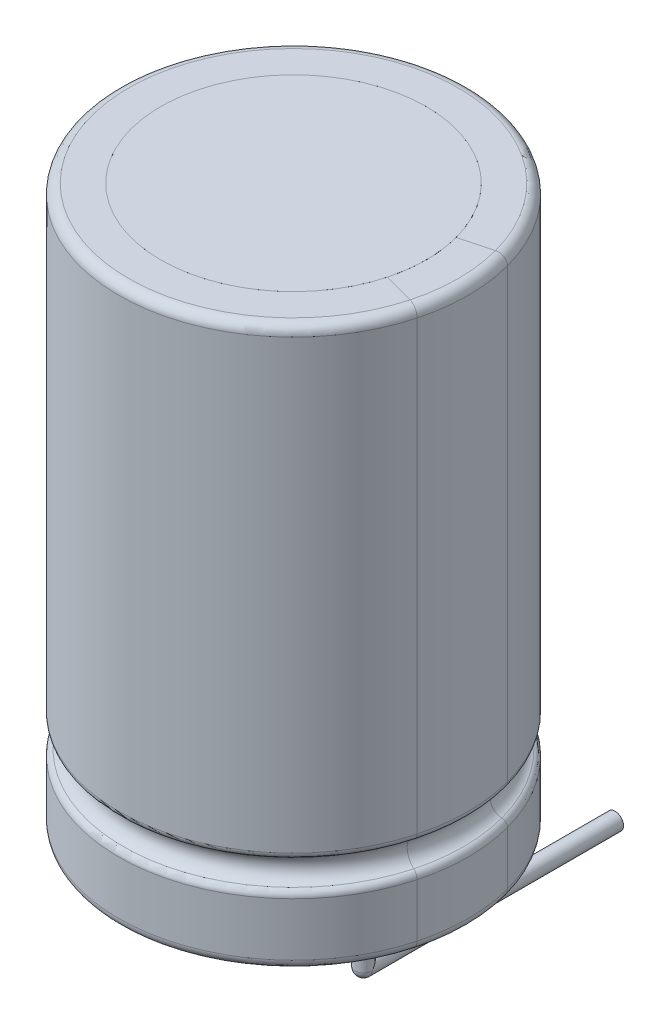
from build123d import *

# Parameters (mm, degrees)
SALIENTE_EXTRUIR2_DEPTH   = 20
SALIENTE_EXTRUIR3_DEPTH   = 20
SALIENTE_EXTRUIR4_DEPTH   = 20
REDONDEO1_R               = 0.35
REDONDEO2_R               = 0.35
REDONDEO3_R               = 0.35
CROQUIS3_R                = 0.5000000000000007
REDONDEO4_R               = 0.25
REDONDEO5_R               = 0.25
CROQUIS4_R                = 0.3000000000000001
SALIENTE_EXTRUIR7_DEPTH   = 3
SALIENTE_EXTRUIR7_2_DEPTH = 3
CROQUIS7_R                = 0.3000000000000001
SALIENTE_EXTRUIR9_DEPTH   = 9


with BuildPart() as part:
    # Croquis2 → Saliente-Extruir2 (new body)
    with BuildSketch(Plane(origin=(0, 0, 0), x_dir=(1, 0, 0), z_dir=(0, 1, 0))):
        with BuildLine():
            ThreePointArc((4.75, 0), (4.709363091525599, 0.619999413045247), (4.588147674873073, 1.2293904642369773))
            ThreePointArc((4.588147674873073, 1.2293904642369773), (-4.75, 5.8e-16), (4.588147674873073, -1.2293904642369775))
            ThreePointArc((4.588147674873073, -1.2293904642369775), (4.709363091525598, -0.6199994130452497), (4.75, -1.16e-15))
        make_face()
    extrude(amount=SALIENTE_EXTRUIR2_DEPTH)


with BuildPart() as body_2:
    # Croquis2<4> → Saliente-Extruir3 (new body)
    with BuildSketch(Plane(origin=(0, 0, 0), x_dir=(1, 0, 0), z_dir=(0, 1, 0))):
        with BuildLine():
            ThreePointArc((4.588147674873073, -1.2293904642369775), (-4.75, 5.8e-16), (4.588147674873073, 1.2293904642369773))
            Line((4.588147674873073, 1.2293904642369773), (6.037036414306675, 1.6176190318907595))
            ThreePointArc((6.037036414306676, 1.6176190318907597), (-6.25, -2.01e-15), (6.037036414306676, -1.6176190318907597))
            Line((6.037036414306676, -1.6176190318907584), (4.588147674873074, -1.2293904642369764))
        make_face()
    extrude(amount=SALIENTE_EXTRUIR3_DEPTH)

    # Redondeo1
    redondeo1_edges = [body_2.edges().sort_by_distance(p)[0] for p in [
        (-6.25, 20, 1.1e-16),
    ]]
    fillet(redondeo1_edges, radius=REDONDEO1_R)

    # Redondeo3
    redondeo3_edges = [body_2.edges().sort_by_distance(p)[0] for p in [
        (-6.25, 0, 1.1e-16),
    ]]
    fillet(redondeo3_edges, radius=REDONDEO3_R)


with BuildPart() as body_3:
    # Croquis2<5> → Saliente-Extruir4 (new body)
    with BuildSketch(Plane(origin=(0, 0, 0), x_dir=(1, 0, 0), z_dir=(0, 1, 0))):
        with BuildLine():
            Line((6.037036414306675, 1.6176190318907595), (4.588147674873073, 1.2293904642369773))
            ThreePointArc((4.588147674873073, 1.2293904642369773), (4.709363091525599, 0.619999413045247), (4.75, 0))
            ThreePointArc((4.75, -1.16e-15), (4.709363091525598, -0.6199994130452497), (4.588147674873073, -1.2293904642369775))
            Line((4.588147674873074, -1.2293904642369764), (6.037036414306676, -1.6176190318907584))
            ThreePointArc((6.037036414306676, -1.6176190318907597), (6.196530383586314, -0.8157887013753286), (6.25, -1.53e-15))
            ThreePointArc((6.25, 0), (6.196530383586315, 0.8157887013753251), (6.037036414306676, 1.6176190318907597))
        make_face()
    extrude(amount=SALIENTE_EXTRUIR4_DEPTH)

    # Redondeo2
    redondeo2_edges = [body_3.edges().sort_by_distance(p)[0] for p in [
        (6.250000000000001, 0, -1.08e-15),
        (6.250000000000001, 20, -4.4e-16),
    ]]
    fillet(redondeo2_edges, radius=REDONDEO2_R)


with BuildPart() as cortar_revoluci_n1_tool:
    # Croquis3 → Cortar-Revolución1 (revolve)
    with BuildSketch(Plane(origin=(0, 0, 0), x_dir=(0, 0, -1), z_dir=(1, 0, 0))):
        with Locations((-6.25, 2.9604719545593716)):
            Circle(CROQUIS3_R)
    revolve(axis=Axis((0, -3.768376338244027, 0), (0, 1, 0)))


with BuildPart() as body_2_1:
    add(body_2.part)

    # Cortar-Revolución1: cut by cortar_revoluci_n1_tool
    add(cortar_revoluci_n1_tool.part, mode=Mode.SUBTRACT)

    # Redondeo5
    redondeo5_edges = [body_2_1.edges().sort_by_distance(p)[0] for p in [
        (-4.95845837682022, 2.460471954559371, -3.8047589313045034),
        (-4.95845837682022, 3.460471954559372, -3.8047589313045034),
    ]]
    fillet(redondeo5_edges, radius=REDONDEO5_R)


with BuildPart() as body_3_1:
    add(body_3.part)

    # Cortar-Revolución1: cut by cortar_revoluci_n1_tool
    add(cortar_revoluci_n1_tool.part, mode=Mode.SUBTRACT)

    # Redondeo4
    redondeo4_edges = [body_3_1.edges().sort_by_distance(p)[0] for p in [
        (6.250000000849846, 2.460471954559371, -1.2367063e-10),
        (6.250000000987957, 3.460471954559372, -1.2092249e-10),
    ]]
    fillet(redondeo4_edges, radius=REDONDEO4_R)


with BuildPart() as body_4:
    # Croquis4 → Saliente-Extruir7 (new body)
    with BuildSketch(Plane(origin=(0, 0, 0), x_dir=(1, 0, 0), z_dir=(0, 1, 0))):
        with Locations((-2.504104344006213, 0)):
            Circle(CROQUIS4_R)
    extrude(amount=-SALIENTE_EXTRUIR7_DEPTH)



with BuildPart() as body_5:
    # Croquis4 → Saliente-Extruir7 2 (new body)
    with BuildSketch(Plane(origin=(0, 0, 0), x_dir=(1, 0, 0), z_dir=(0, 1, 0))):
        with Locations((2.504104344006213, 0)):
            Circle(CROQUIS4_R)
    extrude(amount=-SALIENTE_EXTRUIR7_2_DEPTH)


with BuildPart() as body_4_1:
    add(body_4.part)

    add(body_5.part)  # Saliente-Extruir9 merges body 5
    # Croquis7 → Saliente-Extruir9 (add)
    with BuildSketch(Plane.XY):
        with Locations((-2.504104344006213, -3)):
            Circle(CROQUIS7_R)
        with Locations((2.504104344006213, -3)):
            Circle(CROQUIS7_R)
    extrude(amount=-SALIENTE_EXTRUIR9_DEPTH)

    # Croquis8 → Revolución5 (revolve)
    with BuildSketch(Plane.XY):
        with BuildLine():
            Line((2.8041043440062134, -3), (2.2041043440062134, -3))
            ThreePointArc((2.2041043440062134, -3), (2.504104344006213, -3.3), (2.8041043440062134, -3))
        make_face()
    revolve(axis=Axis((2.8041043440062134, -3, 0), (-1, 0, 0)))

    # Croquis8<3> → Revolución6 (revolve)
    with BuildSketch(Plane.XY):
        with BuildLine():
            Line((2.8041043440062134, -3), (2.2041043440062134, -3))
            ThreePointArc((2.2041043440062134, -3), (2.504104344006213, -3.3), (2.8041043440062134, -3))
        make_face()
        with BuildLine():
            Line((-2.2041043440062134, -3), (-2.8041043440062134, -3))
            ThreePointArc((-2.8041043440062134, -3), (-2.504104344006213, -3.3000000000000003), (-2.2041043440062134, -3))
        make_face()
    revolve(axis=Axis((2.8041043440062134, -3, 0), (-1, 0, 0)))


solid = Compound([part.part, body_2_1.part, body_3_1.part, body_4_1.part])
